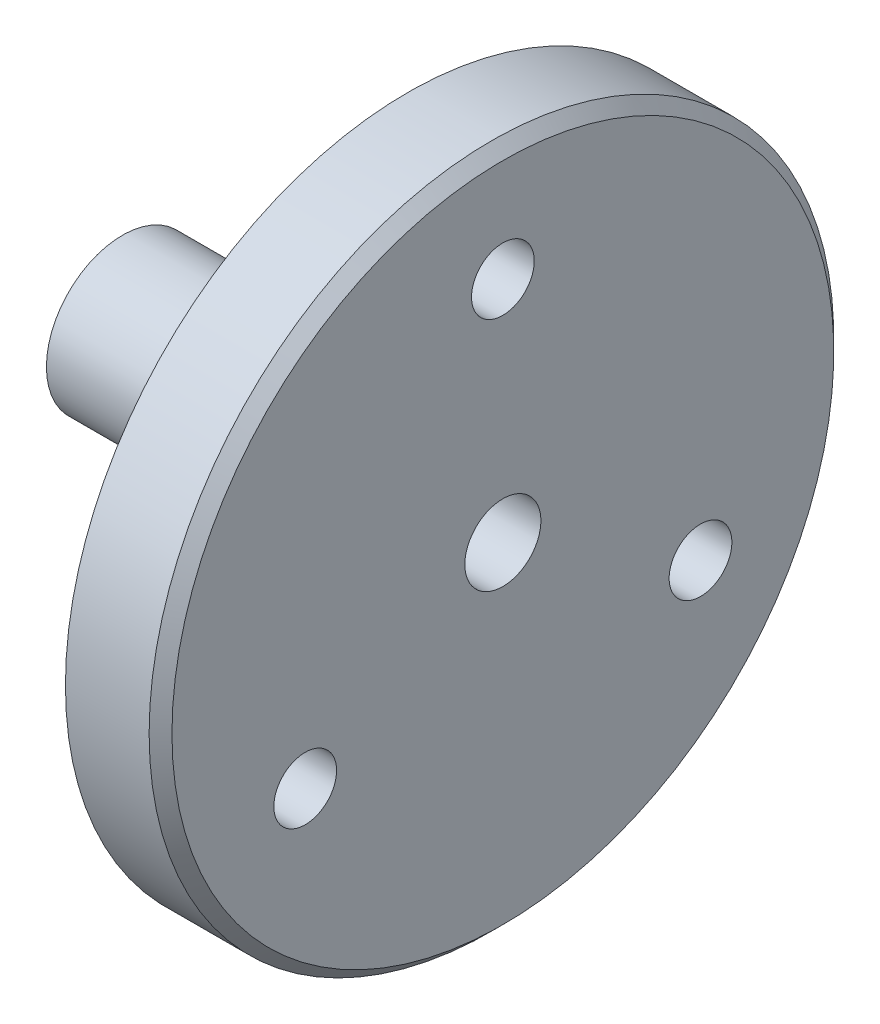
from build123d import *

# Parameters (mm, degrees)
ESQUISSE2_R                  = 1.25
ENL_V_MAT_EXTRU_1_DEPTH      = 33.372828112
TROU_TARAUD_M41_D            = 3.3
R_P_TITION_CIRCULAIRE1_COUNT = 3
CHANFREIN1_SIZE              = 0.6


with BuildPart() as part:
    # Esquisse1 → Révolution1 (revolve)
    with BuildSketch(Plane.XY, mode=Mode.PRIVATE) as r_volution1_sk:
        Polygon((0, 2), (20, 2), (20, 18), (15, 18), (15, 7.5), (9, 7.5), (9, 4), (0, 4), align=None)
    revolve(r_volution1_sk.sketch.rotate(Axis((0, 0, 0), (1, 0, 0)), 90), axis=Axis((0, 0, 0), (1, 0, 0)))

    # Esquisse2 → Enlèv. mat.-Extru.1 (cut, through all)
    with BuildSketch(Plane.XY):
        with Locations((12, 0)):
            Circle(ESQUISSE2_R)
    extrude(amount=-ENL_V_MAT_EXTRU_1_DEPTH, mode=Mode.SUBTRACT)

    # Trou taraudé M41 (through all)
    with Locations(Plane(origin=(20, 0, 0), x_dir=(0, 0, -1), z_dir=(1, 0, 0))):
        with Locations((0, 12)):
            trou_taraud_m41 = Hole(TROU_TARAUD_M41_D / 2)

    # Répétition circulaire1: Trou taraudé M41 ×3 about axis
    r_p_tition_circulaire1_axis = Axis((0, 0, 0), (1, 0, 0))
    for i in range(1, R_P_TITION_CIRCULAIRE1_COUNT):
        add(trou_taraud_m41.rotate(r_p_tition_circulaire1_axis, i * 360 / R_P_TITION_CIRCULAIRE1_COUNT), mode=Mode.SUBTRACT)

    # Chanfrein1
    chanfrein1_edges = [part.edges().sort_by_distance(p)[0] for p in [
        (20, 0, -18),
    ]]
    chamfer(chanfrein1_edges, length=CHANFREIN1_SIZE)


solid = part.part
